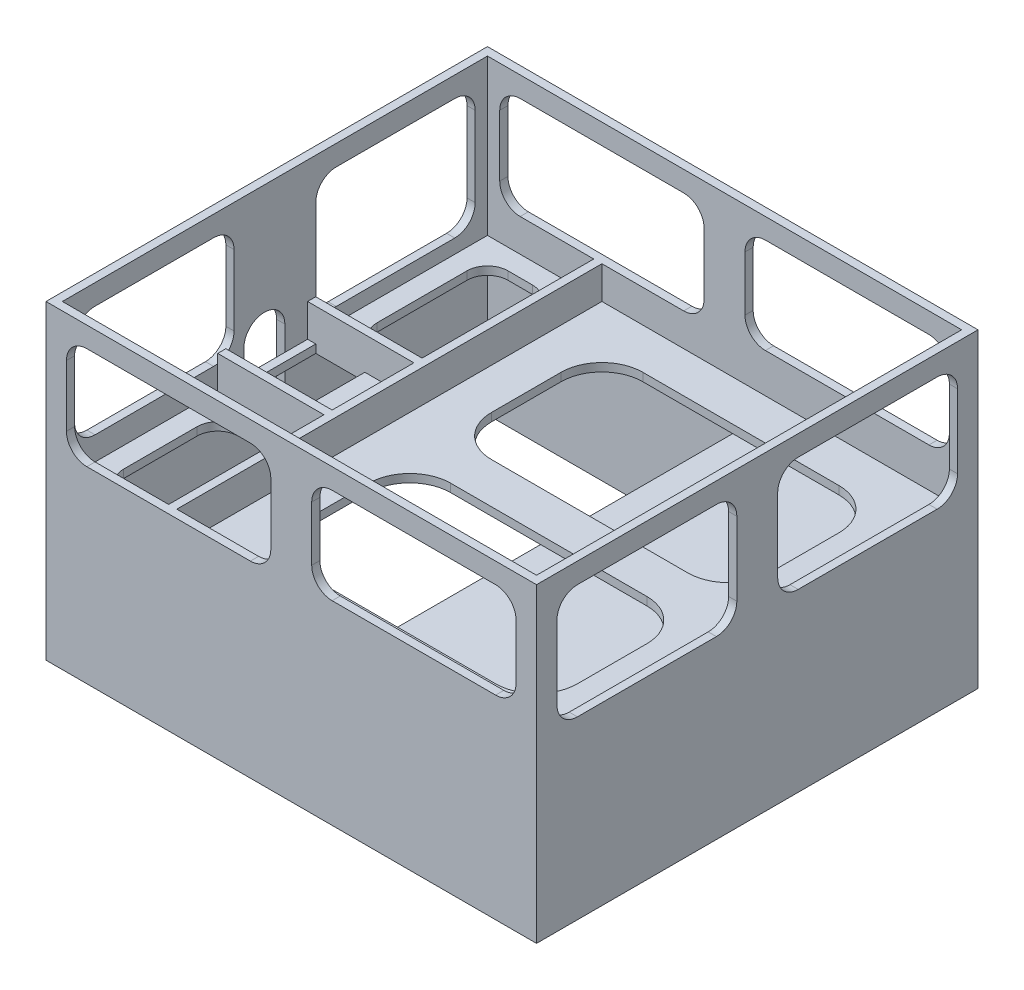
from build123d import *

# Parameters (mm, degrees)
SKETCH1_W           = 60
SKETCH1_H           = 54
BOSS_EXTRUDE1_DEPTH = 38
SKETCH2_W           = 44
SKETCH2_H           = 52
CUT_EXTRUDE1_DEPTH  = 19
SKETCH3_W           = 35
SKETCH3_H           = 52
CUT_EXTRUDE2_DEPTH  = 18
SKETCH4_W           = 6
SKETCH4_H           = 10
CUT_EXTRUDE3_DEPTH  = 38
SKETCH5_W           = 14
SKETCH5_H           = 52
CUT_EXTRUDE5_DEPTH  = 15
SKETCH6_W           = 13
SKETCH6_H           = 52
CUT_EXTRUDE6_DEPTH  = 4
SKETCH8_W           = 15
SKETCH8_H           = 13
CUT_EXTRUDE7_DEPTH  = 6
SKETCH10_W          = 13
SKETCH10_H          = 5
CUT_EXTRUDE8_DEPTH  = 6
SKETCH11_W          = 4
SKETCH11_H          = 5
CUT_EXTRUDE9_DEPTH  = 3
SKETCH12_W          = 5
SKETCH12_H          = 2
CUT_EXTRUDE10_DEPTH = 13
CUT_EXTRUDE11_DEPTH = 1
SKETCH14_W          = 13
SKETCH14_H          = 1
BOSS_EXTRUDE2_DEPTH = 4
SKETCH15_W          = 13
SKETCH15_H          = 1
BOSS_EXTRUDE3_DEPTH = 4
CUT_EXTRUDE12_DEPTH = 1
CUT_EXTRUDE13_DEPTH = 1
CUT_EXTRUDE14_DEPTH = 1
CUT_EXTRUDE15_DEPTH = 60
CUT_EXTRUDE16_START = -1
CUT_EXTRUDE16_DEPTH = 1


with BuildPart() as part:
    # Sketch1 → Boss-Extrude1 (new body)
    with BuildSketch(Plane(origin=(0, 0, 0), x_dir=(1, 0, 0), z_dir=(0, 1, 0))):
        with Locations((-83.874465942, -33.946435202)):
            Rectangle(SKETCH1_W, SKETCH1_H)
    extrude(amount=BOSS_EXTRUDE1_DEPTH)

    # Sketch2 → Cut-Extrude1 (cut)
    with BuildSketch(Plane(origin=(0, 38, 0), x_dir=(1, 0, 0), z_dir=(0, 1, 0))):
        with Locations((-76.874465942, -33.946435202)):
            Rectangle(SKETCH2_W, SKETCH2_H)
    extrude(amount=-CUT_EXTRUDE1_DEPTH, mode=Mode.SUBTRACT)

    # Sketch3 → Cut-Extrude2 (cut)
    with BuildSketch(Plane(origin=(0, 0, 0), x_dir=(-1, 0, 0), z_dir=(0, -1, 0))):
        with Locations((95.374465942, -33.946435202)):
            Rectangle(SKETCH3_W, SKETCH3_H)
    extrude(amount=-CUT_EXTRUDE2_DEPTH, mode=Mode.SUBTRACT)

    # Sketch4 → Cut-Extrude3 (cut)
    with BuildSketch(Plane(origin=(0, 18, 0), x_dir=(-1, 0, 0), z_dir=(0, -1, 0))):
        with Locations((108.874465942, -34.946435202)):
            Rectangle(SKETCH4_W, SKETCH4_H)
    extrude(amount=-CUT_EXTRUDE3_DEPTH, mode=Mode.SUBTRACT)

    # Sketch5 → Cut-Extrude5 (cut)
    with BuildSketch(Plane(origin=(0, 38, 0), x_dir=(1, 0, 0), z_dir=(0, 1, 0))):
        with Locations((-105.874465942, -33.946435202)):
            Rectangle(SKETCH5_W, SKETCH5_H)
    extrude(amount=-CUT_EXTRUDE5_DEPTH, mode=Mode.SUBTRACT)

    # Sketch6 → Cut-Extrude6 (cut)
    with BuildSketch(Plane(origin=(0, 23, 0), x_dir=(1, 0, 0), z_dir=(0, 1, 0))):
        with Locations((-106.374465942, -33.946435202)):
            Rectangle(SKETCH6_W, SKETCH6_H)
    extrude(amount=-CUT_EXTRUDE6_DEPTH, mode=Mode.SUBTRACT)

    # Sketch8 → Cut-Extrude7 (cut)
    with BuildSketch(Plane(origin=(0, 0, 0), x_dir=(-1, 0, 0), z_dir=(0, -1, 0))):
        with Locations((65.874465942, -17.946435202)):
            Rectangle(SKETCH8_W, SKETCH8_H)
    extrude(amount=-CUT_EXTRUDE7_DEPTH, mode=Mode.SUBTRACT)

    # Sketch10 → Cut-Extrude8 (cut)
    with BuildSketch(Plane(origin=(-73.374465942, 0, 0), x_dir=(0, 0, -1), z_dir=(1, 0, 0))):
        with Locations((-17.946435202, 3.5)):
            Rectangle(SKETCH10_W, SKETCH10_H)
    extrude(amount=-CUT_EXTRUDE8_DEPTH, mode=Mode.SUBTRACT)

    # Sketch11 → Cut-Extrude9 (cut)
    with BuildSketch(Plane.XZ):
        with Locations((-65.874465942, 48.446435202)):
            Rectangle(SKETCH11_W, SKETCH11_H)
    extrude(amount=-CUT_EXTRUDE9_DEPTH, mode=Mode.SUBTRACT)

    # Sketch12 → Cut-Extrude10 (cut)
    with BuildSketch(Plane(origin=(-67.874465942, 0, 0), x_dir=(0, 0, -1), z_dir=(1, 0, 0))):
        with Locations((-48.446435202, 2)):
            Rectangle(SKETCH12_W, SKETCH12_H)
    extrude(amount=-CUT_EXTRUDE10_DEPTH, mode=Mode.SUBTRACT)

    # Sketch13 → Cut-Extrude11 (cut)
    with BuildSketch(Plane.ZY.offset(113.874465942)):
        with BuildLine():
            Line((32.733045904, 15), (32.733045904, 22))
            ThreePointArc((32.733045904, 22), (35.233045904, 24.5), (37.733045904, 22))
            Line((37.733045904, 22), (37.733045904, 15))
            ThreePointArc((37.733045904, 15), (35.233045904, 12.5), (32.733045904, 15))
        make_face()
    extrude(amount=-CUT_EXTRUDE11_DEPTH, mode=Mode.SUBTRACT)

    # Sketch14 → Boss-Extrude2 (add)
    with BuildSketch(Plane(origin=(0, 19, 0), x_dir=(1, 0, 0), z_dir=(0, 1, 0))):
        with Locations((-106.374465942, -40.446435202)):
            Rectangle(SKETCH14_W, SKETCH14_H)
    extrude(amount=BOSS_EXTRUDE2_DEPTH)

    # Sketch15 → Boss-Extrude3 (add)
    with BuildSketch(Plane(origin=(0, 19, 0), x_dir=(1, 0, 0), z_dir=(0, 1, 0))):
        with Locations((-106.374465942, -29.446435202)):
            Rectangle(SKETCH15_W, SKETCH15_H)
    extrude(amount=BOSS_EXTRUDE3_DEPTH)

    # Sketch16 → Cut-Extrude12 (cut)
    with BuildSketch(Plane(origin=(0, 19, 0), x_dir=(1, 0, 0), z_dir=(0, 1, 0))):
        with BuildLine():
            Line((-64.874465942, -54.946435202), (-88.874465942, -54.946435202))
            ThreePointArc((-88.874465942, -54.946435202), (-92.409999848, -53.481969108), (-93.874465942, -49.946435202))
            Line((-93.874465942, -49.946435202), (-93.874465942, -41.446435202))
            ThreePointArc((-93.874465942, -41.446435202), (-92.409999848, -37.910901296), (-88.874465942, -36.446435202))
            Line((-88.874465942, -36.446435202), (-64.874465942, -36.446435202))
            ThreePointArc((-64.874465942, -36.446435202), (-61.338932037, -37.910901296), (-59.874465942, -41.446435202))
            Line((-59.874465942, -41.446435202), (-59.874465942, -49.946435202))
            ThreePointArc((-59.874465942, -49.946435202), (-61.338932037, -53.481969108), (-64.874465942, -54.946435202))
        make_face()
        with BuildLine():
            Line((-88.874465942, -31.446435202), (-64.874465942, -31.446435202))
            ThreePointArc((-64.874465942, -31.446435202), (-61.338932037, -29.981969108), (-59.874465942, -26.446435202))
            Line((-59.874465942, -26.446435202), (-59.874465942, -17.946435202))
            ThreePointArc((-59.874465942, -17.946435202), (-61.338932037, -14.410901296), (-64.874465942, -12.946435202))
            Line((-64.874465942, -12.946435202), (-88.874465942, -12.946435202))
            ThreePointArc((-88.874465942, -12.946435202), (-92.409999848, -14.410901296), (-93.874465942, -17.946435202))
            Line((-93.874465942, -17.946435202), (-93.874465942, -26.446435202))
            ThreePointArc((-93.874465942, -26.446435202), (-92.409999848, -29.981969108), (-88.874465942, -31.446435202))
        make_face()
    extrude(amount=-CUT_EXTRUDE12_DEPTH, mode=Mode.SUBTRACT)

    # Sketch17 → Cut-Extrude13 (cut)
    with BuildSketch(Plane(origin=(0, 19, 0), x_dir=(1, 0, 0), z_dir=(0, 1, 0))):
        with BuildLine():
            Line((-104.874465942, -57.446435202), (-107.874465942, -57.446435202))
            ThreePointArc((-107.874465942, -57.446435202), (-109.642232895, -56.714202155), (-110.374465942, -54.946435202))
            Line((-110.374465942, -54.946435202), (-110.374465942, -45.946435202))
            ThreePointArc((-110.374465942, -45.946435202), (-109.642232895, -44.178668249), (-107.874465942, -43.446435202))
            Line((-107.874465942, -43.446435202), (-104.874465942, -43.446435202))
            ThreePointArc((-104.874465942, -43.446435202), (-103.10669899, -44.178668249), (-102.374465942, -45.946435202))
            Line((-102.374465942, -45.946435202), (-102.374465942, -54.946435202))
            ThreePointArc((-102.374465942, -54.946435202), (-103.10669899, -56.714202155), (-104.874465942, -57.446435202))
        make_face()
        with BuildLine():
            Line((-104.874465942, -26.446435202), (-107.874465942, -26.446435202))
            ThreePointArc((-107.874465942, -26.446435202), (-109.642232895, -25.714202155), (-110.374465942, -23.946435202))
            Line((-110.374465942, -23.946435202), (-110.374465942, -12.946435202))
            ThreePointArc((-110.374465942, -12.946435202), (-109.642232895, -11.178668249), (-107.874465942, -10.446435202))
            Line((-107.874465942, -10.446435202), (-104.874465942, -10.446435202))
            ThreePointArc((-104.874465942, -10.446435202), (-103.10669899, -11.178668249), (-102.374465942, -12.946435202))
            Line((-102.374465942, -12.946435202), (-102.374465942, -23.946435202))
            ThreePointArc((-102.374465942, -23.946435202), (-103.10669899, -25.714202155), (-104.874465942, -26.446435202))
        make_face()
    extrude(amount=-CUT_EXTRUDE13_DEPTH, mode=Mode.SUBTRACT)

    # Sketch18 → Cut-Extrude14 (cut)
    with BuildSketch(Plane(origin=(-53.874465942, 0, 0), x_dir=(0, 0, -1), z_dir=(1, 0, 0))):
        with BuildLine():
            Line((-55.946435202, 35.5), (-38.946435202, 35.5))
            ThreePointArc((-38.946435202, 35.5), (-37.178668249, 34.767766953), (-36.446435202, 33))
            Line((-36.446435202, 33), (-36.446435202, 24))
            ThreePointArc((-36.446435202, 24), (-37.178668249, 22.232233047), (-38.946435202, 21.5))
            Line((-38.946435202, 21.5), (-55.946435202, 21.5))
            ThreePointArc((-55.946435202, 21.5), (-57.714202155, 22.232233047), (-58.446435202, 24))
            Line((-58.446435202, 24), (-58.446435202, 33))
            ThreePointArc((-58.446435202, 33), (-57.714202155, 34.767766953), (-55.946435202, 35.5))
        make_face()
        with BuildLine():
            Line((-28.946435202, 35.5), (-11.946435202, 35.5))
            ThreePointArc((-11.946435202, 35.5), (-10.178668249, 34.767766953), (-9.446435202, 33))
            Line((-9.446435202, 33), (-9.446435202, 24))
            ThreePointArc((-9.446435202, 24), (-10.178668249, 22.232233047), (-11.946435202, 21.5))
            Line((-11.946435202, 21.5), (-28.946435202, 21.5))
            ThreePointArc((-28.946435202, 21.5), (-30.714202155, 22.232233047), (-31.446435202, 24))
            Line((-31.446435202, 24), (-31.446435202, 33))
            ThreePointArc((-31.446435202, 33), (-30.714202155, 34.767766953), (-28.946435202, 35.5))
        make_face()
    extrude(amount=-CUT_EXTRUDE14_DEPTH, mode=Mode.SUBTRACT)

    # Sketch19 → Cut-Extrude15 (cut)
    with BuildSketch(Plane(origin=(0, 0, 6.946435202), x_dir=(-1, 0, 0), z_dir=(0, 0, -1))):
        with BuildLine():
            Line((58.874465942, 35.5), (78.874465942, 35.5))
            ThreePointArc((78.874465942, 35.5), (80.642232895, 34.767766953), (81.374465942, 33))
            Line((81.374465942, 33), (81.374465942, 26.304053451))
            ThreePointArc((81.374465942, 26.304053451), (80.642232895, 24.536286498), (78.874465942, 23.804053451))
            Line((78.874465942, 23.804053451), (58.874465942, 23.804053451))
            ThreePointArc((58.874465942, 23.804053451), (57.10669899, 24.536286498), (56.374465942, 26.304053451))
            Line((56.374465942, 26.304053451), (56.374465942, 33))
            ThreePointArc((56.374465942, 33), (57.10669899, 34.767766953), (58.874465942, 35.5))
        make_face()
        with BuildLine():
            Line((88.874465942, 35.5), (108.874465942, 35.5))
            ThreePointArc((108.874465942, 35.5), (110.642232895, 34.767766953), (111.374465942, 33))
            Line((111.374465942, 33), (111.374465942, 25.5))
            ThreePointArc((111.374465942, 25.5), (110.642232895, 23.732233047), (108.874465942, 23))
            Line((108.874465942, 23), (88.874465942, 23))
            ThreePointArc((88.874465942, 23), (87.10669899, 23.732233047), (86.374465942, 25.5))
            Line((86.374465942, 25.5), (86.374465942, 33))
            ThreePointArc((86.374465942, 33), (87.10669899, 34.767766953), (88.874465942, 35.5))
        make_face()
    extrude(amount=-CUT_EXTRUDE15_DEPTH, mode=Mode.SUBTRACT)

    # Sketch20 → Cut-Extrude16 (cut)
    with BuildSketch(Plane.ZY.offset(113.874465942).offset(CUT_EXTRUDE16_START)):
        with BuildLine():
            Line((11.946435202, 35.5), (26.446435202, 35.5))
            ThreePointArc((26.446435202, 35.5), (28.214202155, 34.767766953), (28.946435202, 33))
            Line((28.946435202, 33), (28.946435202, 23.221982389))
            ThreePointArc((28.946435202, 23.221982389), (28.214202155, 21.454215436), (26.446435202, 20.721982389))
            Line((26.446435202, 20.721982389), (11.946435202, 20.721982389))
            ThreePointArc((11.946435202, 20.721982389), (10.178668249, 21.454215436), (9.446435202, 23.221982389))
            Line((9.446435202, 23.221982389), (9.446435202, 33))
            ThreePointArc((9.446435202, 33), (10.178668249, 34.767766953), (11.946435202, 35.5))
        make_face()
        with BuildLine():
            Line((41.446435202, 35.5), (55.946435202, 35.5))
            ThreePointArc((55.946435202, 35.5), (57.714202155, 34.767766953), (58.446435202, 33))
            Line((58.446435202, 33), (58.446435202, 24.375603128))
            ThreePointArc((58.446435202, 24.375603128), (57.714202155, 22.607836175), (55.946435202, 21.875603128))
            Line((55.946435202, 21.875603128), (41.446435202, 21.875603128))
            ThreePointArc((41.446435202, 21.875603128), (39.678668249, 22.607836175), (38.946435202, 24.375603128))
            Line((38.946435202, 24.375603128), (38.946435202, 33))
            ThreePointArc((38.946435202, 33), (39.678668249, 34.767766953), (41.446435202, 35.5))
        make_face()
    extrude(amount=CUT_EXTRUDE16_DEPTH, mode=Mode.SUBTRACT)


solid = part.part
